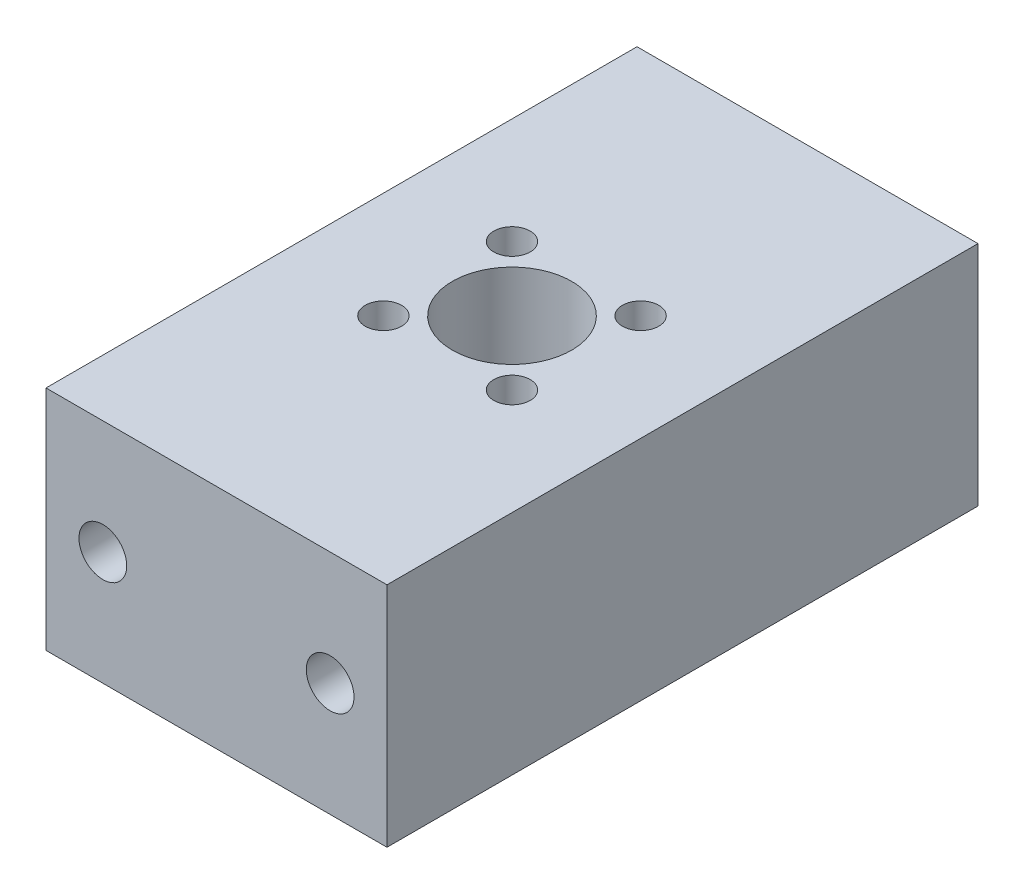
from build123d import *

# Parameters (mm, degrees)
SKETCH_1_W          = 30
SKETCH_1_H          = 20
SKETCH_1_R          = 2.1
EXTRUDE_1_DEPTH     = 52
SKETCH_2_R          = 5.25
SKETCH_2_R_2        = 1.6
CUT_EXTRUDE_1_DEPTH = 64.277168078


with BuildPart() as part:
    # 草图1 → 凸台-拉伸1 (new body)
    with BuildSketch(Plane.XY):
        with Locations((15, 10)):
            Rectangle(SKETCH_1_W, SKETCH_1_H)
        with Locations(Location((5, 10, 0), (0, 0, 180))):
            Circle(SKETCH_1_R, mode=Mode.SUBTRACT)
        with Locations(Location((25, 10, 0), (0, 0, 180))):
            Circle(SKETCH_1_R, mode=Mode.SUBTRACT)
    extrude(amount=EXTRUDE_1_DEPTH)

    # 草图2 → 切除-拉伸1 (cut, through all)
    with BuildSketch(Plane(origin=(0, 20, 0), x_dir=(1, 0, 0), z_dir=(0, 1, 0))):
        with Locations(Location((15, -26, 0), (0, 0, 270))):
            Circle(SKETCH_2_R)
        with Locations(Location((9.343145751, -31.656854249, 0), (0, 0, 270))):
            Circle(SKETCH_2_R_2)
        with Locations(Location((9.343145751, -20.343145751, 0), (0, 0, 270))):
            Circle(SKETCH_2_R_2)
        with Locations(Location((20.656854249, -20.343145751, 0), (0, 0, 270))):
            Circle(SKETCH_2_R_2)
        with Locations(Location((20.656854249, -31.656854249, 0), (0, 0, 270))):
            Circle(SKETCH_2_R_2)
    extrude(amount=-CUT_EXTRUDE_1_DEPTH, mode=Mode.SUBTRACT)


solid = part.part
